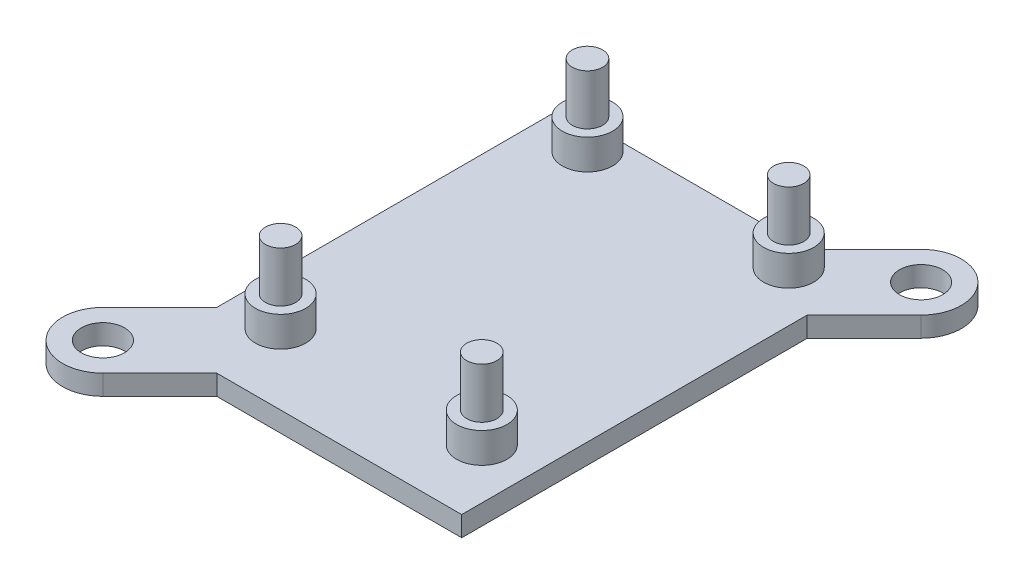
from build123d import *

# Parameters (mm, degrees)
SKETCH1_R           = 2.15
BOSS_EXTRUDE1_DEPTH = 2
SKETCH2_R           = 1.5
BOSS_EXTRUDE2_DEPTH = 10
SKETCH3_R           = 2.5
BOSS_EXTRUDE3_DEPTH = 5


with BuildPart() as part:
    # Sketch1 → Boss-Extrude1 (new body)
    with BuildSketch(Plane(origin=(0, 0, 0), x_dir=(1, 0, 0), z_dir=(0, 1, 0))):
        with BuildLine():
            Line((24.343145751, 0), (0, 0))
            Line((0, 0), (0, -34.343145751))
            Line((0, -34.343145751), (-5.656854249, -40))
            ThreePointArc((-5.656854249, -40), (-5.656854249, -45.656854249), (0, -45.656854249))
            Line((0, -45.656854249), (5.656854249, -40))
            Line((5.656854249, -40), (30, -40))
            Line((30, -40), (30, -5.656854249))
            Line((30, -5.656854249), (35.656854249, 0))
            ThreePointArc((35.656854249, 0), (35.656854249, 5.656854249), (30, 5.656854249))
            Line((30, 5.656854249), (24.343145751, 0))
        make_face()
        with Locations(Location((32.828427125, 2.828427125, 0), (0, 0, 270))):
            Circle(SKETCH1_R, mode=Mode.SUBTRACT)
        with Locations(Location((-2.828427125, -42.828427125, 0), (0, 0, 270))):
            Circle(SKETCH1_R, mode=Mode.SUBTRACT)
    extrude(amount=BOSS_EXTRUDE1_DEPTH)

    # Sketch2 → Boss-Extrude2 (add)
    with BuildSketch(Plane(origin=(0, 0, 0), x_dir=(1, 0, 0), z_dir=(0, 1, 0))):
        with Locations(Location((25, -2.5, 0), (0, 0, 270))):
            Circle(SKETCH2_R)
        with Locations(Location((25, -33, 0), (0, 0, 270))):
            Circle(SKETCH2_R)
        with Locations(Location((5, -33, 0), (0, 0, 270))):
            Circle(SKETCH2_R)
        with Locations(Location((5, -2.5, 0), (0, 0, 270))):
            Circle(SKETCH2_R)
    extrude(amount=BOSS_EXTRUDE2_DEPTH)

    # Sketch3 → Boss-Extrude3 (add)
    with BuildSketch(Plane(origin=(0, 0, 0), x_dir=(1, 0, 0), z_dir=(0, 1, 0))):
        with Locations(Location((5, -2.5, 0), (0, 0, 90))):
            Circle(SKETCH3_R)
        with Locations(Location((25, -2.5, 0), (0, 0, 270))):
            Circle(SKETCH3_R)
        with Locations(Location((25, -33, 0), (0, 0, 270))):
            Circle(SKETCH3_R)
        with Locations(Location((5, -33, 0), (0, 0, 270))):
            Circle(SKETCH3_R)
    extrude(amount=BOSS_EXTRUDE3_DEPTH)


solid = part.part
